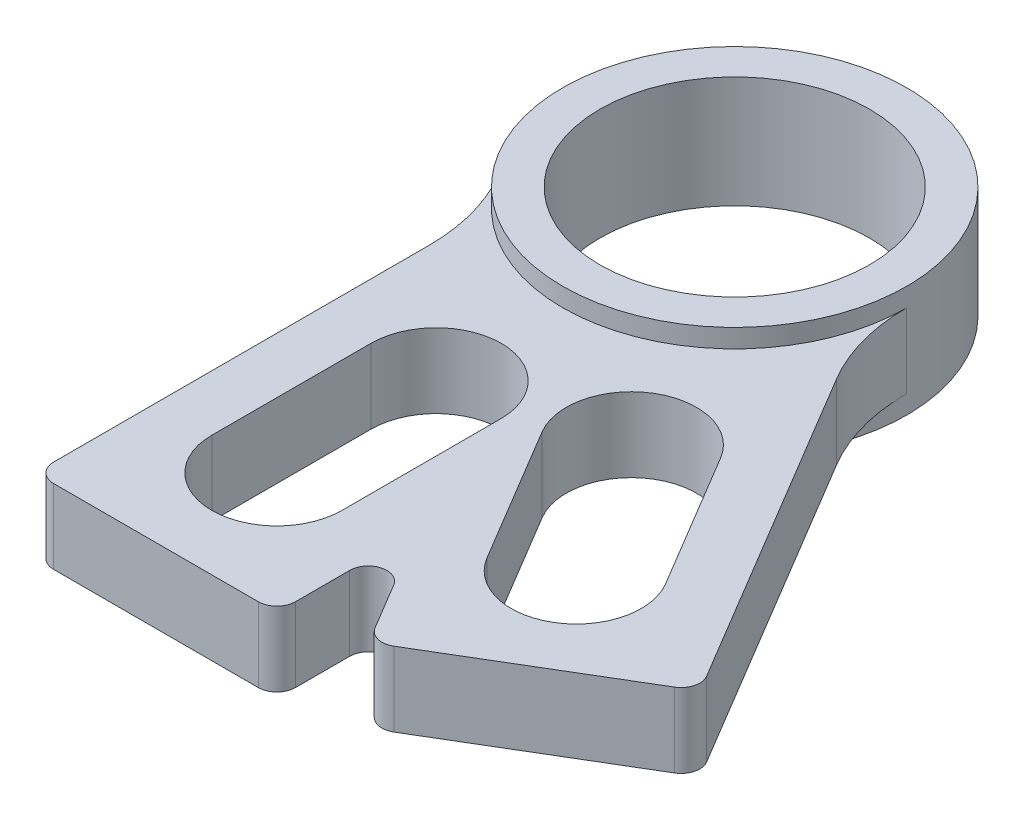
from build123d import *

# Parameters (mm, degrees)
SKETCH1_R                      = 14.6812
SKETCH1_R_2                    = 11.5062
BEARING_INSERT_EXTRUDE_DEPTH   = 4.7625
APEX_SLOT_INSERT_EXTRUDE_DEPTH = 3.175
FILLET1_R                      = 16.002
FILLET2_R                      = 1.5875


with BuildPart() as part:
    # Sketch1 → Bearing_Insert_Extrude (new, symmetric)
    with BuildSketch(Plane(origin=(0, 0, 0), x_dir=(1, 0, 0), z_dir=(0, 1, 0))):
        with Locations(Location((0, 0, 0), (0, 0, 90))):
            Circle(SKETCH1_R)
        with Locations(Location((0, 0, 0), (0, 0, 90))):
            Circle(SKETCH1_R_2, mode=Mode.SUBTRACT)
    extrude(amount=BEARING_INSERT_EXTRUDE_DEPTH, both=True)

    # Sketch1<4> → Apex_Slot_Insert_Extrude (add, symmetric)
    with BuildSketch(Plane(origin=(0, 0, 0), x_dir=(1, 0, 0), z_dir=(0, 1, 0))):
        with BuildLine():
            Line((-10.31875, -10.443228997), (-10.31875, -49.3903))
            Line((-10.31875, -49.3903), (10.31875, -49.3903))
            Line((10.31875, -49.3903), (10.31875, -37.419698802))
            Line((10.31875, -37.419698802), (16.454159196, -47.698416963))
            Line((16.454159196, -47.698416963), (34.174826901, -37.120877441))
            Line((34.174826901, -37.120877441), (14.21290405, -3.67844966))
            ThreePointArc((14.21290405, -3.67844966), (3.902777064, -14.152948973), (-10.31875, -10.443228997))
        make_face()
        with BuildLine():
            ThreePointArc((5.55625, -39.07155), (0, -44.6278), (-5.55625, -39.07155))
            Line((-5.55625, -39.07155), (-5.55625, -25.48255))
            ThreePointArc((-5.55625, -25.48255), (0, -19.9263), (5.55625, -25.48255))
            Line((5.55625, -25.48255), (5.55625, -39.07155))
        make_face(mode=Mode.SUBTRACT)
        with BuildLine():
            ThreePointArc((24.796672284, -30.701514247), (22.873522389, -38.320262347), (15.25477429, -36.397112452))
            Line((15.25477429, -36.397112452), (8.289871342, -24.728734333))
            ThreePointArc((8.289871342, -24.728734333), (10.213021238, -17.109986233), (17.831769337, -19.033136128))
            Line((17.831769337, -19.033136128), (24.796672284, -30.701514247))
        make_face(mode=Mode.SUBTRACT)
    extrude(amount=APEX_SLOT_INSERT_EXTRUDE_DEPTH, both=True)

    # Fillet1
    fillet1_edges = [part.edges().sort_by_distance(p)[0] for p in [
        (14.21290405, 0, 3.67844966),
        (-10.31875, 0, 10.443228997),
    ]]
    fillet(fillet1_edges, radius=FILLET1_R)

    # Fillet2
    fillet2_edges = [part.edges().sort_by_distance(p)[0] for p in [
        (-10.31875, 0, 49.3903),
        (10.31875, 0, 49.3903),
        (10.31875, 0, 37.419698802),
        (16.454159196, 0, 47.698416963),
        (34.174826901, 0, 37.120877441),
    ]]
    fillet(fillet2_edges, radius=FILLET2_R)


solid = part.part
